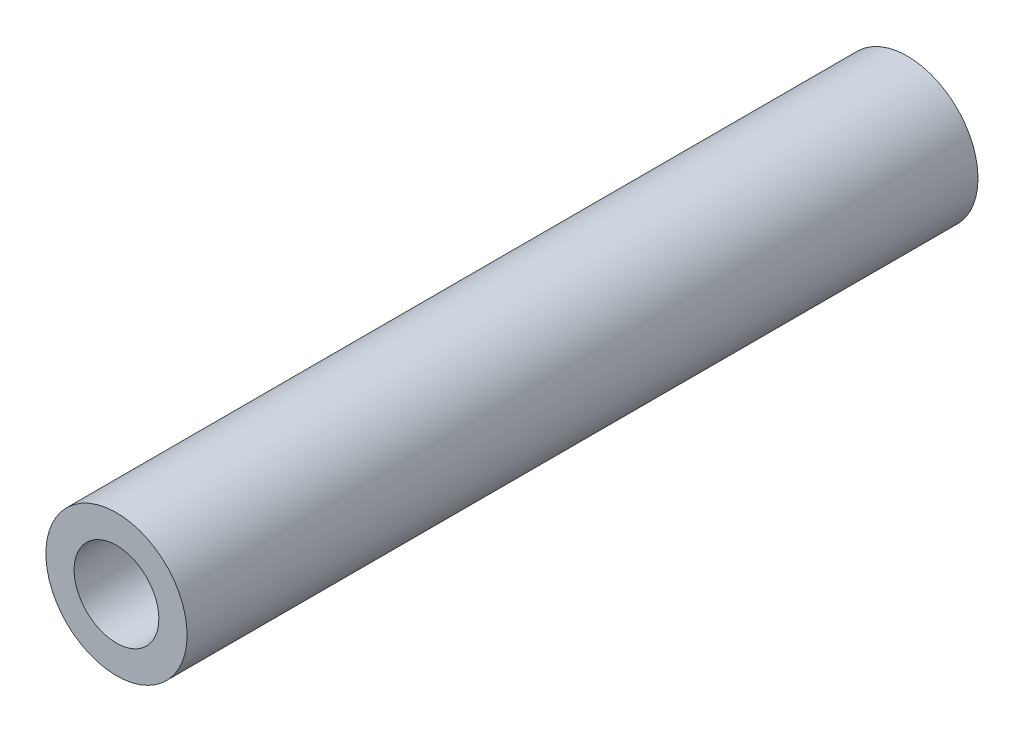
from build123d import *

# Parameters (mm, degrees)
CROQUIS1_R              = 2.5
CROQUIS1_R_2            = 1.5
SALIENTE_EXTRUIR1_DEPTH = 28


with BuildPart() as part:
    # Croquis1 → Saliente-Extruir1 (new body)
    with BuildSketch(Plane.XY):
        Circle(CROQUIS1_R)
        Circle(CROQUIS1_R_2, mode=Mode.SUBTRACT)
    extrude(amount=SALIENTE_EXTRUIR1_DEPTH)


solid = part.part
